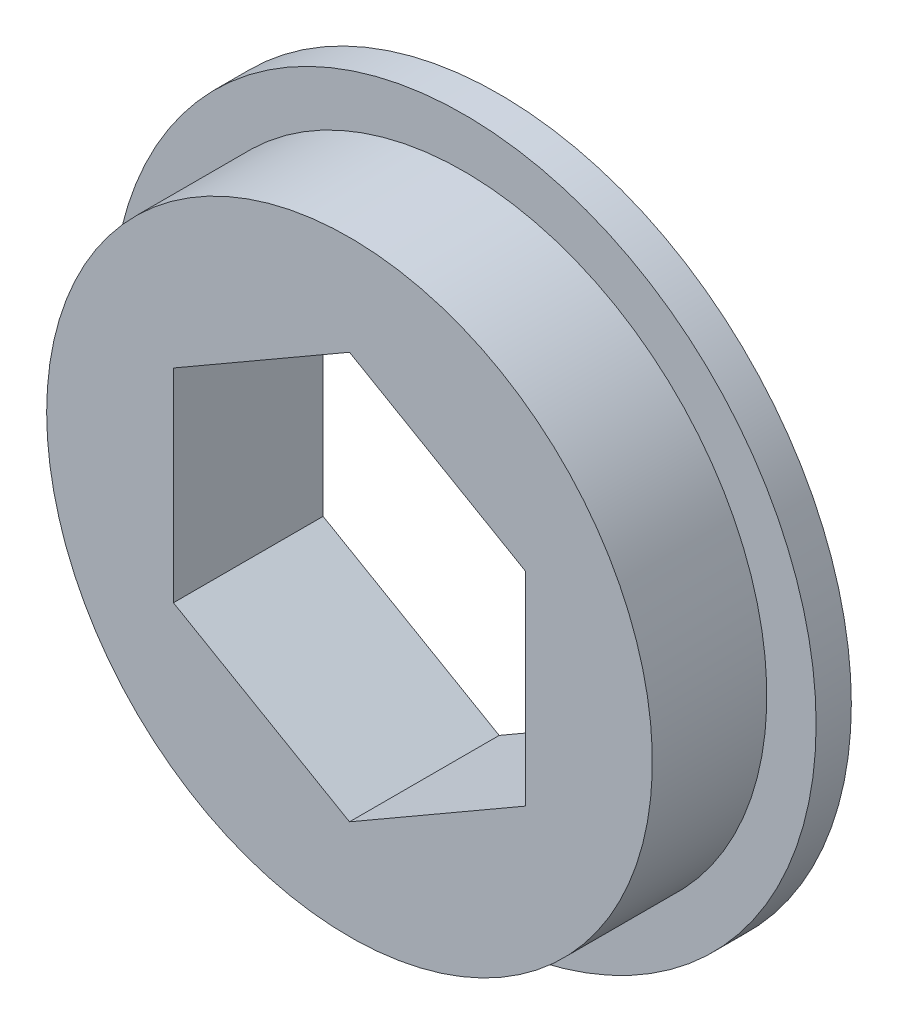
from build123d import *

# Parameters (mm, degrees)
SKETCH1_R           = 20
BOSS_EXTRUDE1_DEPTH = 2
SKETCH2_R           = 17.2
BOSS_EXTRUDE2_DEPTH = 6.5
CUT_EXTRUDE1_DEPTH  = 30.533878851


with BuildPart() as part:
    # Sketch1 → Boss-Extrude1 (new body)
    with BuildSketch(Plane.XY):
        Circle(SKETCH1_R)
    extrude(amount=BOSS_EXTRUDE1_DEPTH)

    # Sketch2 → Boss-Extrude2 (add)
    with BuildSketch(Plane.XY.offset(2)):
        with Locations(Location((0, 0, 0), (0, 0, 180))):
            Circle(SKETCH2_R)
    extrude(amount=BOSS_EXTRUDE2_DEPTH)

    # Sketch3 → Cut-Extrude1 (cut, through all)
    with BuildSketch(Plane.XY.offset(8.5)):
        Polygon((0, 11.547005384), (-10, 5.773502692), (-10, -5.773502692), (0, -11.547005384), (10, -5.773502692), (10, 5.773502692), align=None)
    extrude(amount=-CUT_EXTRUDE1_DEPTH, mode=Mode.SUBTRACT)


solid = part.part
